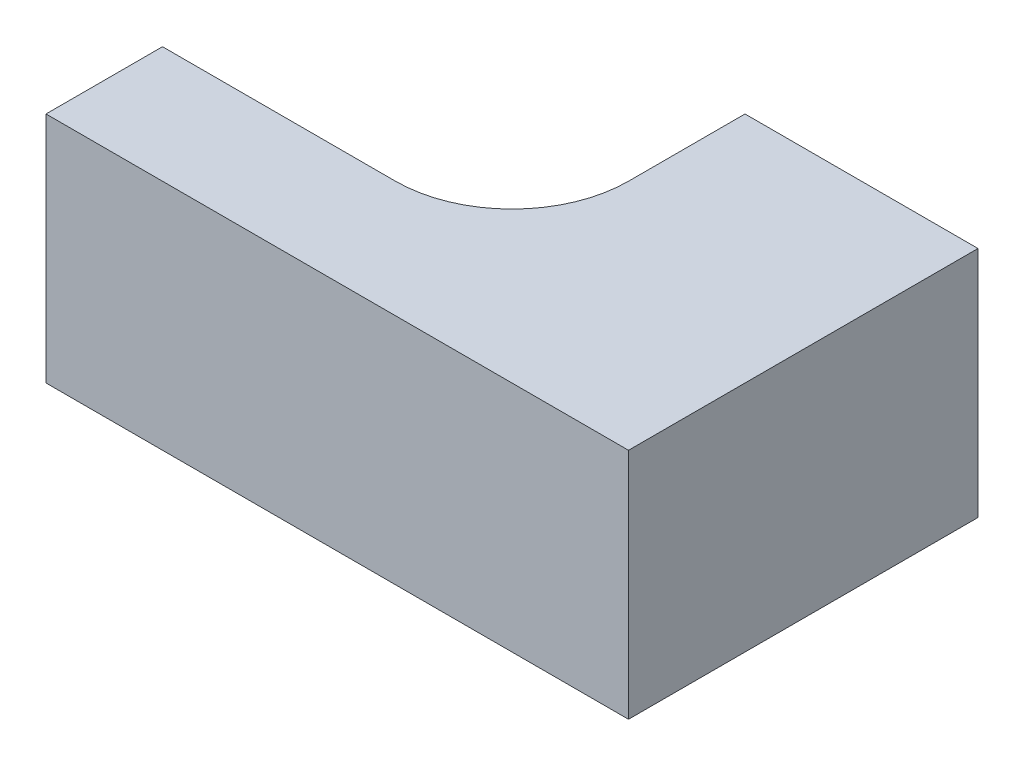
from build123d import *

# Parameters (mm, degrees)
BOSS_EXTRUDE1_DEPTH = 20


with BuildPart() as part:
    # Sketch2 → Boss-Extrude1 (new body)
    with BuildSketch(Plane(origin=(0, 0, 0), x_dir=(1, 0, 0), z_dir=(0, 1, 0))):
        with BuildLine():
            Line((0, 0), (0, -10))
            ThreePointArc((0, -10), (2.928932188, -17.071067812), (10, -20))
            Line((10, -20), (30, -20))
            Line((30, -20), (30, -30))
            Line((30, -30), (-20, -30))
            Line((-20, -30), (-20, 0))
            Line((-20, 0), (0, 0))
        make_face()
    extrude(amount=BOSS_EXTRUDE1_DEPTH)


with BuildPart() as body_2:
    # Mirror1: mirrored copy
    add(part.part.mirror(Plane(origin=(-20, 20, 30), x_dir=(0, 0, 1), z_dir=(1, 0, 0))))


solid = body_2.part
